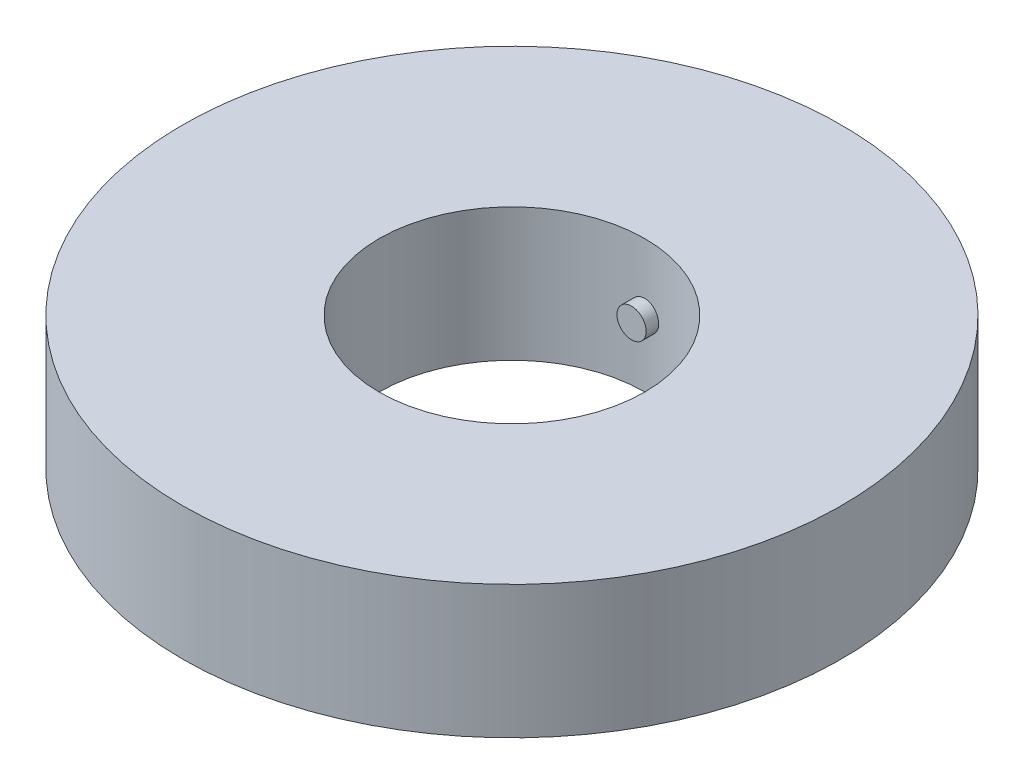
from build123d import *

# Parameters (mm, degrees)
SKETCH1_R           = 31.496
SKETCH1_R_2         = 12.7
BOSS_EXTRUDE1_DEPTH = 12.7
BOSS_EXTRUDE2_START = -5.08
SKETCH3_R           = 1.397
BOSS_EXTRUDE2_DEPTH = 6.35


with BuildPart() as part:
    # Sketch1 → Boss-Extrude1 (new body)
    with BuildSketch(Plane(origin=(0, 0, 0), x_dir=(1, 0, 0), z_dir=(0, 1, 0))):
        with Locations(Location((0, 0, 0), (0, 0, 270))):
            Circle(SKETCH1_R)
        with Locations(Location((0, 0, 0), (0, 0, 270))):
            Circle(SKETCH1_R_2, mode=Mode.SUBTRACT)
    extrude(amount=BOSS_EXTRUDE1_DEPTH)

    # Sketch3 → Boss-Extrude2 (add)
    with BuildSketch(Plane.XY.offset(-12.7).offset(BOSS_EXTRUDE2_START)):
        with Locations((0, 6.35)):
            Circle(SKETCH3_R)
    boss_extrude2 = extrude(amount=BOSS_EXTRUDE2_DEPTH)

    # Mirror1: Boss-Extrude2 across plane
    add(boss_extrude2.mirror(Plane.XY))


solid = part.part
